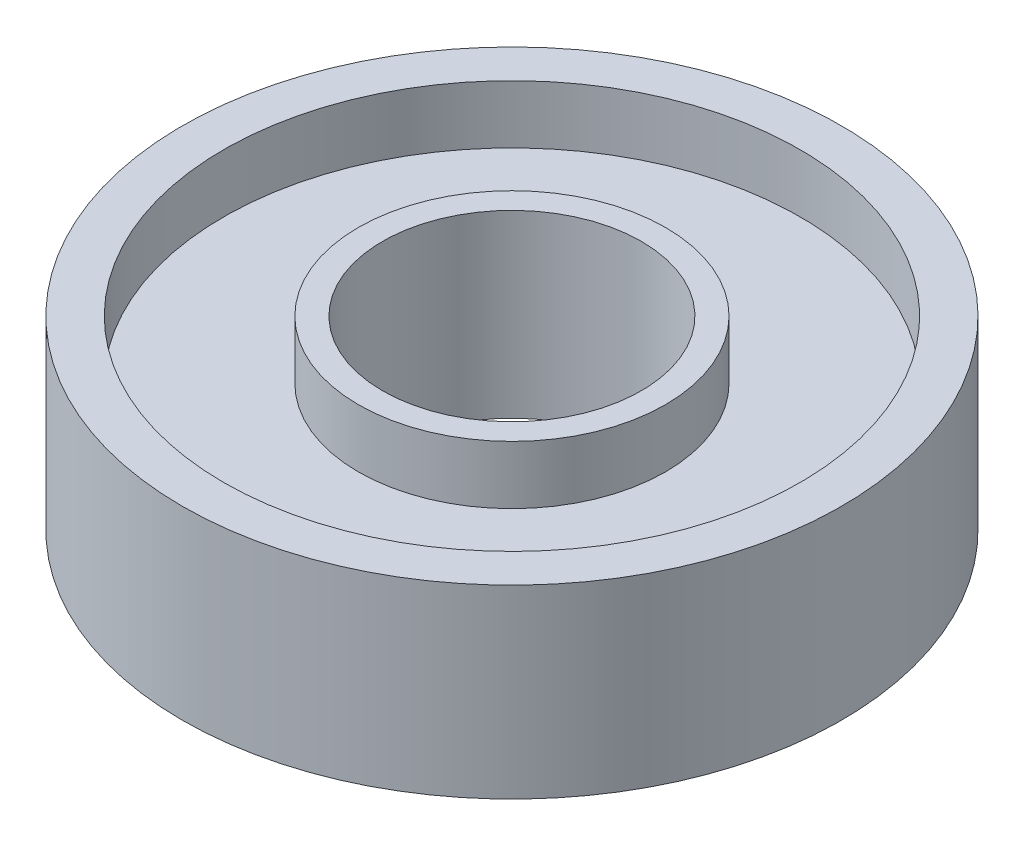
from build123d import *

# Parameters (mm, degrees)
SKETCH1_R           = 12.45
BOSS_EXTRUDE1_DEPTH = 7
SKETCH2_R           = 4.89
CUT_EXTRUDE1_DEPTH  = 19.947427266
SKETCH3_R           = 10.89
SKETCH3_R_2         = 5.8
CUT_EXTRUDE2_DEPTH  = 2.2
SKETCH4_R           = 11.15
CUT_EXTRUDE3_DEPTH  = 0.2


with BuildPart() as part:
    # Sketch1 → Boss-Extrude1 (new body)
    with BuildSketch(Plane(origin=(0, 0, 0), x_dir=(1, 0, 0), z_dir=(0, 1, 0))):
        with Locations(Location((0, 0, 0), (0, 0, 270))):
            Circle(SKETCH1_R)
    extrude(amount=BOSS_EXTRUDE1_DEPTH)

    # Sketch2 → Cut-Extrude1 (cut, through all)
    with BuildSketch(Plane(origin=(0, 7, 0), x_dir=(1, 0, 0), z_dir=(0, 1, 0))):
        with Locations(Location((0, 0, 0), (0, 0, 270))):
            Circle(SKETCH2_R)
    extrude(amount=-CUT_EXTRUDE1_DEPTH, mode=Mode.SUBTRACT)

    # Sketch3 → Cut-Extrude2 (cut)
    with BuildSketch(Plane(origin=(0, 7, 0), x_dir=(1, 0, 0), z_dir=(0, 1, 0))):
        with Locations(Location((0, 0, 0), (0, 0, 270))):
            Circle(SKETCH3_R)
        with Locations(Location((0, 0, 0), (0, 0, 270))):
            Circle(SKETCH3_R_2, mode=Mode.SUBTRACT)
    extrude(amount=-CUT_EXTRUDE2_DEPTH, mode=Mode.SUBTRACT)

    # Sketch4 → Cut-Extrude3 (cut)
    with BuildSketch(Plane.XZ):
        with Locations(Location((0, 0, 0), (0, 0, 270))):
            Circle(SKETCH4_R)
    extrude(amount=-CUT_EXTRUDE3_DEPTH, mode=Mode.SUBTRACT)


solid = part.part
